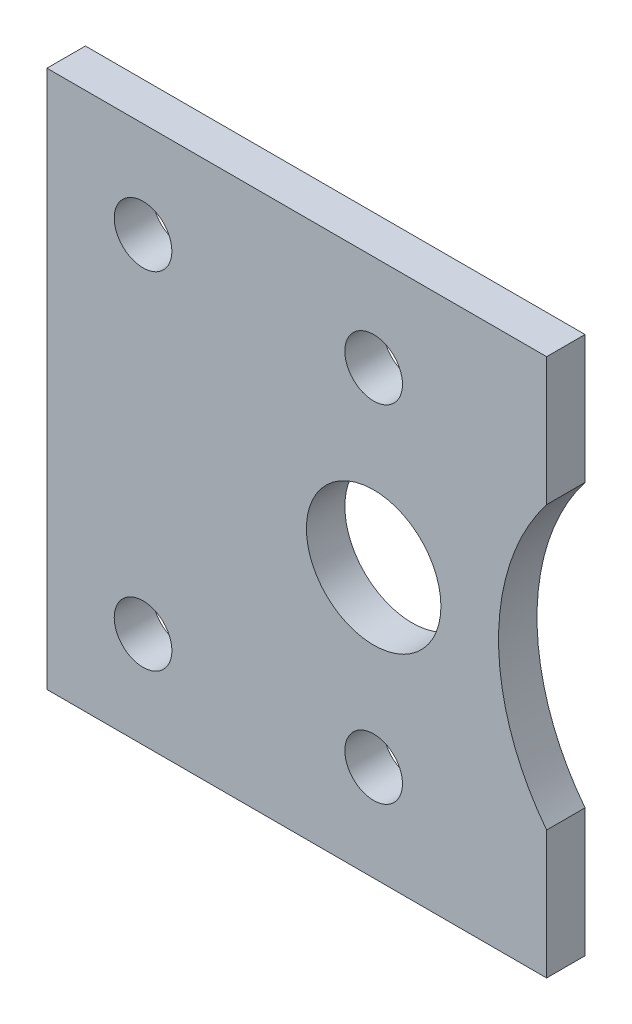
from build123d import *

# Parameters (mm, degrees)
SKETCH1_R           = 3.5
SKETCH1_R_2         = 1.5
BOSS_EXTRUDE1_DEPTH = 2


with BuildPart() as part:
    # Sketch1 → Boss-Extrude1 (new body)
    with BuildSketch(Plane.XY):
        with BuildLine():
            Line((9, 14), (-17, 14))
            Line((-17, 14), (-17, -14))
            Line((-17, -14), (9, -14))
            Line((9, -14), (9, -7.331439149))
            ThreePointArc((9, -7.331439149), (6.5, 0), (9, 7.331439149))
            Line((9, 7.331439149), (9, 14))
        make_face()
        Circle(SKETCH1_R, mode=Mode.SUBTRACT)
        with Locations((0, 9)):
            Circle(SKETCH1_R_2, mode=Mode.SUBTRACT)
        with Locations((-12, 9)):
            Circle(SKETCH1_R_2, mode=Mode.SUBTRACT)
        with Locations(Location((-12, -9, 0), (0, 0, 180))):
            Circle(SKETCH1_R_2, mode=Mode.SUBTRACT)
        with Locations(Location((0, -9, 0), (0, 0, 180))):
            Circle(SKETCH1_R_2, mode=Mode.SUBTRACT)
    extrude(amount=-BOSS_EXTRUDE1_DEPTH)


solid = part.part
